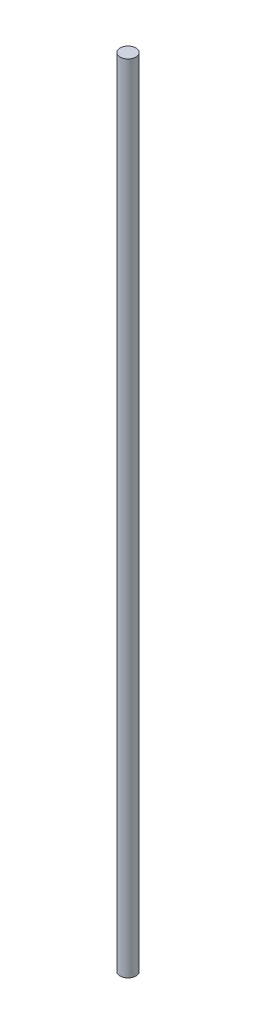
from build123d import *

# Parameters (mm, degrees)
BOSS_EXTRUDE1_DEPTH      = 200
BOSS_EXTRUDE1_DEPTH_BACK = 200
SKETCH1_R                = 4


with BuildPart() as part:
    # Sketch1 → Boss-Extrude1 (new, two sides: drawn at the far end of the back side and taken through both)
    with BuildSketch(Plane(origin=(0, 0, 0), x_dir=(1, 0, 0), z_dir=(0, 1, 0)).offset(-BOSS_EXTRUDE1_DEPTH_BACK)):
        Circle(SKETCH1_R)
    extrude(amount=BOSS_EXTRUDE1_DEPTH + BOSS_EXTRUDE1_DEPTH_BACK)


solid = part.part
